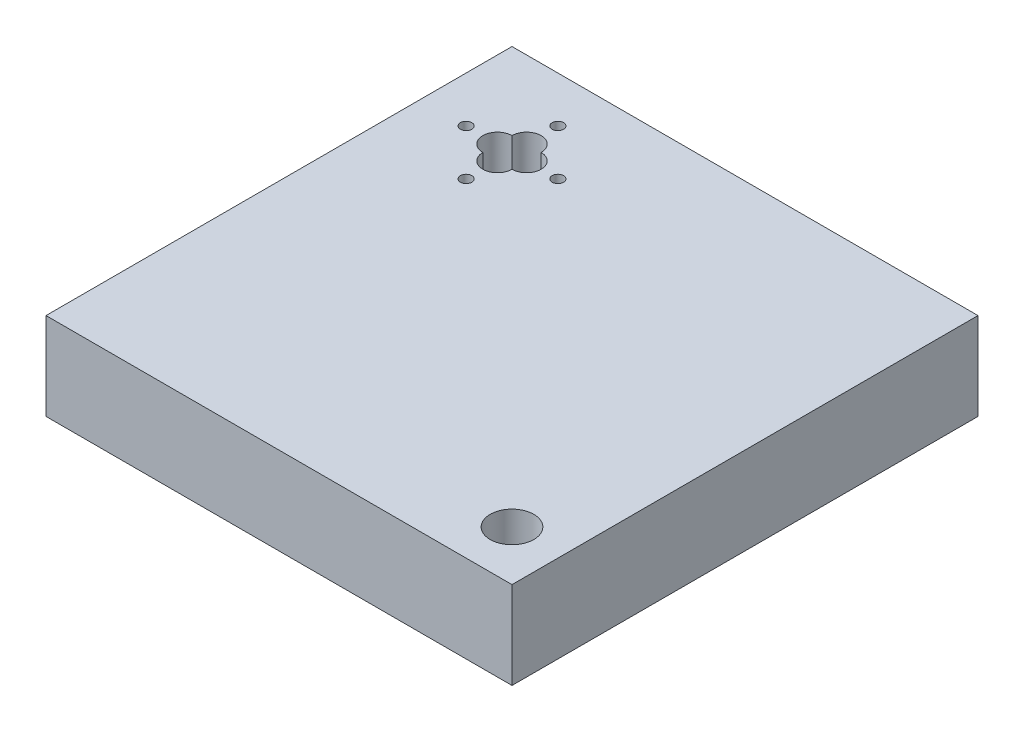
from build123d import *

# Parameters (mm, degrees)
SKETCH2_W                   = 101.6
SKETCH2_H                   = 101.6
SKETCH2_R                   = 4.7625
BOSS_EXTRUDE1_DEPTH         = 19.05
TAP_DRILL_FOR_M3X0_5_TAP1_D = 2.5


with BuildPart() as part:
    # Sketch2 → Boss-Extrude1 (new body)
    with BuildSketch(Plane(origin=(0, 0, 0), x_dir=(1, 0, 0), z_dir=(0, 1, 0))):
        with Locations((30.8, -30.8)):
            Rectangle(SKETCH2_W, SKETCH2_H)
        with Locations(Location((70.710678119, -70.710678119, 0), (0, 0, 270))):
            Circle(SKETCH2_R, mode=Mode.SUBTRACT)
        with BuildLine():
            ThreePointArc((-3.18, -3.18), (-6.36, 0), (-3.18, 3.18))
            ThreePointArc((-3.18, 3.18), (0, 6.36), (3.18, 3.18))
            ThreePointArc((3.18, 3.18), (6.36, 0), (3.18, -3.18))
            ThreePointArc((3.18, -3.18), (0, -6.36), (-3.18, -3.18))
        make_face(mode=Mode.SUBTRACT)
    extrude(amount=-BOSS_EXTRUDE1_DEPTH)

    # Tap Drill for M3x0.5 Tap1 (through all)
    with Locations(Plane(origin=(0, 0, -10), x_dir=(0, 0, 1), z_dir=(0, 1, 0))):
        with Locations((0, 0), (10, 10), (20, 0), (10, -10)):
            Hole(TAP_DRILL_FOR_M3X0_5_TAP1_D / 2)


solid = part.part
